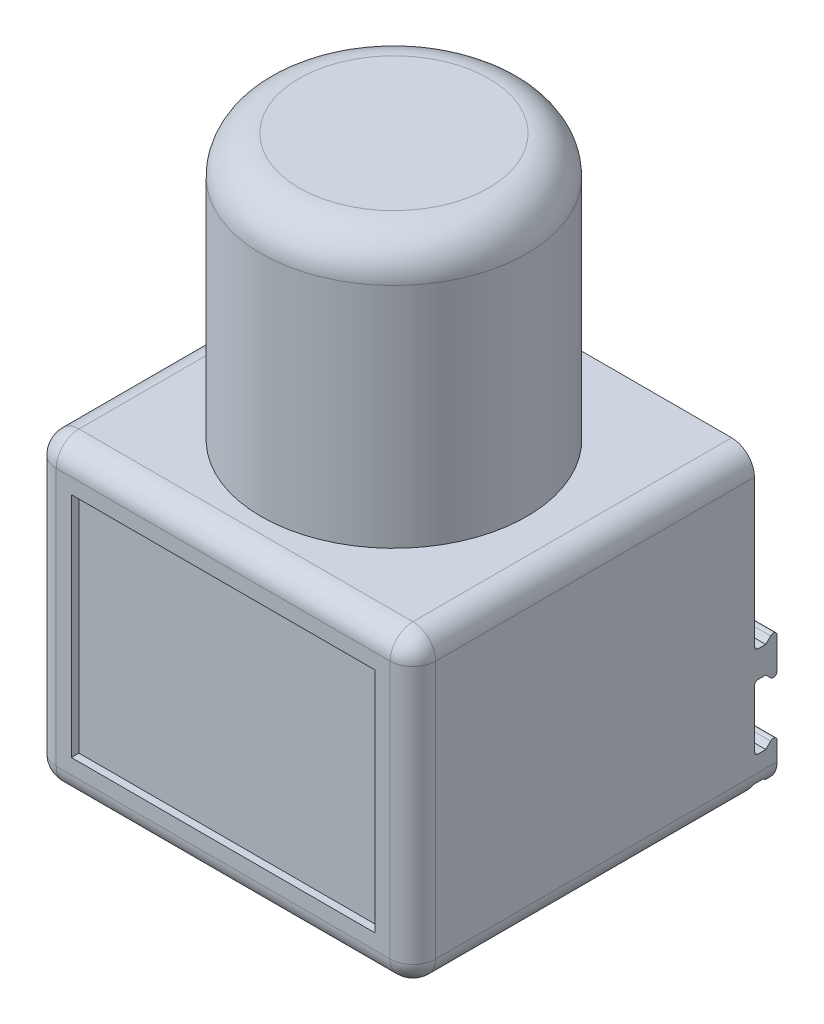
from build123d import *

# Parameters (mm, degrees)
SKETCH1_W           = 500
SKETCH1_H           = 450
BOSS_EXTRUDE1_DEPTH = 200
BOSS_EXTRUDE2_DEPTH = 500
FILLET1_R           = 5
SKETCH3_R           = 150
CUT_EXTRUDE1_DEPTH  = 200
SKETCH4_R           = 175
BOSS_EXTRUDE3_DEPTH = 350
FILLET2_R           = 50
FILLET3_R           = 30
SKETCH5_W           = 400
SKETCH5_H           = 300
CUT_EXTRUDE2_DEPTH  = 10


with BuildPart() as part:
    # Sketch1 → Boss-Extrude1 (new, symmetric)
    with BuildSketch(Plane(origin=(0, 0, 0), x_dir=(1, 0, 0), z_dir=(0, 1, 0))):
        Rectangle(SKETCH1_W, SKETCH1_H)
    extrude(amount=BOSS_EXTRUDE1_DEPTH, both=True)

    # Sketch2 → Boss-Extrude2 (add)
    with BuildSketch(Plane(origin=(250, 0, 0), x_dir=(0, 0, -1), z_dir=(1, 0, 0))):
        Polygon((240, -63.342343109), (255, -78.342343109), (255, -13.342343109), (240, -28.342343109), (225, -28.342343109), (225, -63.342343109), align=None)
        Polygon((225, -183.342343109), (225, -148.342343109), (240, -148.342343109), (255, -133.342343109), (255, -198.342343109), (240, -183.342343109), align=None)
    extrude(amount=-BOSS_EXTRUDE2_DEPTH)

    # Fillet1
    fillet1_edges = [part.edges().sort_by_distance(p)[0] for p in [
        (0, -183.342343109, -225),
        (0, -148.342343109, -225),
        (0, -133.342343109, -255),
        (0, -198.342343109, -255),
        (0, -63.342343109, -225),
        (0, -28.342343109, -225),
        (0, -13.342343109, -255),
        (0, -78.342343109, -255),
    ]]
    fillet(fillet1_edges, radius=FILLET1_R)

    # Sketch3 → Cut-Extrude1 (cut)
    with BuildSketch(Plane.XZ.offset(200)):
        with Locations(Location((0, 0, 0), (0, 0, 270))):
            Circle(SKETCH3_R)
    extrude(amount=-CUT_EXTRUDE1_DEPTH, mode=Mode.SUBTRACT)

    # Sketch4 → Boss-Extrude3 (add)
    with BuildSketch(Plane(origin=(0, 200, 0), x_dir=(1, 0, 0), z_dir=(0, 1, 0))):
        with Locations(Location((0, 0, 0), (0, 0, 270))):
            Circle(SKETCH4_R)
    extrude(amount=BOSS_EXTRUDE3_DEPTH)

    # Fillet2
    fillet2_edges = [part.edges().sort_by_distance(p)[0] for p in [
        (0, 550, -175),
    ]]
    fillet(fillet2_edges, radius=FILLET2_R)

    # Fillet3
    fillet3_edges = [part.edges().sort_by_distance(p)[0] for p in [
        (-250, 0, 225),
        (-250, -200, 0),
        (0, -200, 225),
        (250, -200, 0),
        (250, 0, 225),
        (250, 200, 0),
        (0, 200, 225),
        (-250, 200, 0),
    ]]
    fillet(fillet3_edges, radius=FILLET3_R)

    # Sketch5 → Cut-Extrude2 (cut)
    with BuildSketch(Plane.XY.offset(225)):
        Rectangle(SKETCH5_W, SKETCH5_H)
    extrude(amount=-CUT_EXTRUDE2_DEPTH, mode=Mode.SUBTRACT)


solid = part.part
